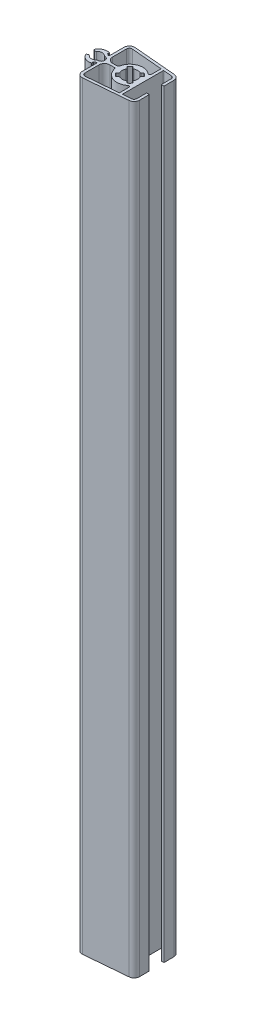
from build123d import *

# Parameters (mm, degrees)
BOSS_EXTRUDE1_DEPTH = 425


with BuildPart() as part:
    # Sketch1 → Boss-Extrude1 (new body)
    with BuildSketch(Plane(origin=(0, 0, 0), x_dir=(1, 0, 0), z_dir=(0, 1, 0))):
        with BuildLine():
            Line((0, 3.65), (0, 11.726074497))
            ThreePointArc((0, 11.726074497), (0.973229377, 13.937906507), (3.261467228, 14.714658591))
            Line((3.261467228, 14.714658591), (27.261467228, 12.614930666))
            ThreePointArc((27.261467228, 12.614930666), (29.21183201, 11.653117195), (30, 9.626346572))
            Line((30, 9.626346572), (30, 4.25))
            ThreePointArc((30, 4.25), (29.956066017, 4.143933983), (29.85, 4.1))
            Line((29.85, 4.1), (28.65, 4.1))
            ThreePointArc((28.65, 4.1), (28.543933983, 4.143933983), (28.5, 4.25))
            Line((28.5, 4.25), (28.5, 9.626346572))
            ThreePointArc((28.5, 9.626346572), (28.105916005, 10.639731884), (27.130733614, 11.120638619))
            Line((27.130733614, 11.120638619), (22.463073361, 11.529005977))
            ThreePointArc((22.463073361, 11.529005977), (22.348661469, 11.490168372), (22.3, 11.379576772))
            Line((22.3, 11.379576772), (22.3, -11.379576772))
            ThreePointArc((22.3, -11.379576772), (22.348661469, -11.490168372), (22.463073361, -11.529005977))
            Line((22.463073361, -11.529005977), (27.130733614, -11.120638619))
            ThreePointArc((27.130733614, -11.120638619), (28.105916005, -10.639731884), (28.5, -9.626346572))
            Line((28.5, -9.626346572), (28.5, -4.25))
            ThreePointArc((28.5, -4.25), (28.543933983, -4.143933983), (28.65, -4.1))
            Line((28.65, -4.1), (29.85, -4.1))
            ThreePointArc((29.85, -4.1), (29.956066017, -4.143933983), (30, -4.25))
            Line((30, -4.25), (30, -9.626346572))
            ThreePointArc((30, -9.626346572), (29.21183201, -11.653117195), (27.261467228, -12.614930666))
            Line((27.261467228, -12.614930666), (3.261467228, -14.714658591))
            ThreePointArc((3.261467228, -14.714658591), (0.973229377, -13.937906507), (0, -11.726074497))
            Line((0, -11.726074497), (0, -3.65))
            ThreePointArc((0, -3.65), (-0.193830765, -3.336772973), (-0.560635258, -3.370477571))
            Line((-0.560635258, -3.370477571), (-1.241594271, -3.883616994))
            ThreePointArc((-1.241594271, -3.883616994), (-1.321364591, -3.936115739), (-1.407159256, -3.978052566))
            ThreePointArc((-1.407159256, -3.978052566), (-1.474647279, -4.03329008), (-1.5, -4.116735006))
            Line((-1.5, -4.116735006), (-1.5, -4.895206856))
            ThreePointArc((-1.5, -4.895206856), (-1.531192993, -4.986775929), (-1.611798603, -5.040260823))
            ThreePointArc((-1.611798603, -5.040260823), (-4.945770747, -4.732123456), (-7.298777867, -2.350175433))
            ThreePointArc((-7.298777867, -2.350175433), (-7.305313905, -2.242111424), (-7.237408738, -2.157793941))
            Line((-7.237408738, -2.157793941), (-6.681980515, -1.837117307))
            ThreePointArc((-6.681980515, -1.837117307), (-6.186662348, -1.74635024), (-5.745584412, -1.989309088))
            ThreePointArc((-5.745584412, -1.989309088), (-3.556386599, -2.999470045), (-1.330769231, -2.072302553))
            ThreePointArc((-1.330769231, -2.072302553), (-1.240582163, -2.011981832), (-1.133333333, -1.995550606))
            ThreePointArc((-1.133333333, -1.995550606), (1, 0), (-1.133333333, 1.995550606))
            ThreePointArc((-1.133333333, 1.995550606), (-1.240582163, 2.011981832), (-1.330769231, 2.072302553))
            ThreePointArc((-1.330769231, 2.072302553), (-3.556386599, 2.999470045), (-5.745584412, 1.989309088))
            ThreePointArc((-5.745584412, 1.989309088), (-6.186662348, 1.74635024), (-6.681980515, 1.837117307))
            Line((-6.681980515, 1.837117307), (-7.237408738, 2.157793941))
            ThreePointArc((-7.237408738, 2.157793941), (-7.305313905, 2.242111424), (-7.298777867, 2.350175433))
            ThreePointArc((-7.298777867, 2.350175433), (-4.945770747, 4.732123456), (-1.611798603, 5.040260823))
            ThreePointArc((-1.611798603, 5.040260823), (-1.531192993, 4.986775929), (-1.5, 4.895206856))
            Line((-1.5, 4.895206856), (-1.5, 4.116735006))
            ThreePointArc((-1.5, 4.116735006), (-1.474647279, 4.03329008), (-1.407159256, 3.978052566))
            ThreePointArc((-1.407159256, 3.978052566), (-1.321364591, 3.936115739), (-1.241594271, 3.883616994))
            Line((-1.241594271, 3.883616994), (-0.560635258, 3.370477571))
            ThreePointArc((-0.560635258, 3.370477571), (-0.193830765, 3.336772973), (0, 3.65))
        make_face()
        with BuildLine():
            Line((1.5, 3.75), (1.5, 11.726074497))
            ThreePointArc((1.5, 11.726074497), (1.986614689, 12.831990502), (3.130733614, 13.220366544))
            Line((3.130733614, 13.220366544), (20.663073361, 11.686485571))
            ThreePointArc((20.663073361, 11.686485571), (20.760591601, 11.638394897), (20.8, 11.537056366))
            Line((20.8, 11.537056366), (20.8, 6.268971207))
            ThreePointArc((20.8, 6.268971207), (20.373749385, 5.592446015), (19.579503106, 5.684905567))
            ThreePointArc((19.579503106, 5.684905567), (12.478865683, 6.850830735), (7.827850799, 1.360248447))
            ThreePointArc((7.827850799, 1.360248447), (7.569361706, 0.92236964), (7.090986155, 0.75))
            Line((7.090986155, 0.75), (4.5, 0.75))
            ThreePointArc((4.5, 0.75), (2.378679656, 1.628679656), (1.5, 3.75))
        make_face(mode=Mode.SUBTRACT)
        with BuildLine():
            Line((3.130733614, -13.220366544), (20.663073361, -11.686485571))
            ThreePointArc((20.663073361, -11.686485571), (20.760591601, -11.638394897), (20.8, -11.537056366))
            Line((20.8, -11.537056366), (20.8, -6.268971207))
            ThreePointArc((20.8, -6.268971207), (20.373749385, -5.592446015), (19.579503106, -5.684905567))
            ThreePointArc((19.579503106, -5.684905567), (12.478865683, -6.850830735), (7.827850799, -1.360248447))
            ThreePointArc((7.827850799, -1.360248447), (7.569361706, -0.92236964), (7.090986155, -0.75))
            Line((7.090986155, -0.75), (4.5, -0.75))
            ThreePointArc((4.5, -0.75), (2.378679656, -1.628679656), (1.5, -3.75))
            Line((1.5, -3.75), (1.5, -11.726074497))
            ThreePointArc((1.5, -11.726074497), (1.986614689, -12.831990502), (3.130733614, -13.220366544))
        make_face(mode=Mode.SUBTRACT)
        with BuildLine():
            Line((11.95237619, 4.744680085), (12.554594319, 4.142461956))
            ThreePointArc((12.554594319, 4.142461956), (12.93723035, 3.937478186), (13.369341573, 3.978813026))
            ThreePointArc((13.369341573, 3.978813026), (15, 4.3), (16.630658427, 3.978813026))
            ThreePointArc((16.630658427, 3.978813026), (17.06276965, 3.937478186), (17.445405681, 4.142461956))
            Line((17.445405681, 4.142461956), (18.04762381, 4.744680085))
            ThreePointArc((18.04762381, 4.744680085), (18.171115834, 4.802453455), (18.302939637, 4.767660826))
            ThreePointArc((18.302939637, 4.767660826), (19.101219331, 4.101219331), (19.767660826, 3.302939637))
            ThreePointArc((19.767660826, 3.302939637), (19.802453455, 3.171115834), (19.744680085, 3.04762381))
            Line((19.744680085, 3.04762381), (19.142461956, 2.445405681))
            ThreePointArc((19.142461956, 2.445405681), (18.937478186, 2.06276965), (18.978813026, 1.630658427))
            ThreePointArc((18.978813026, 1.630658427), (19.3, 0), (18.978813026, -1.630658427))
            ThreePointArc((18.978813026, -1.630658427), (18.937478186, -2.06276965), (19.142461956, -2.445405681))
            Line((19.142461956, -2.445405681), (19.744680085, -3.04762381))
            ThreePointArc((19.744680085, -3.04762381), (19.802453455, -3.171115834), (19.767660826, -3.302939637))
            ThreePointArc((19.767660826, -3.302939637), (19.101219331, -4.101219331), (18.302939637, -4.767660826))
            ThreePointArc((18.302939637, -4.767660826), (18.171115834, -4.802453455), (18.04762381, -4.744680085))
            Line((18.04762381, -4.744680085), (17.445405681, -4.142461956))
            ThreePointArc((17.445405681, -4.142461956), (17.06276965, -3.937478186), (16.630658427, -3.978813026))
            ThreePointArc((16.630658427, -3.978813026), (15, -4.3), (13.369341573, -3.978813026))
            ThreePointArc((13.369341573, -3.978813026), (12.93723035, -3.937478186), (12.554594319, -4.142461956))
            Line((12.554594319, -4.142461956), (11.95237619, -4.744680085))
            ThreePointArc((11.95237619, -4.744680085), (11.828884166, -4.802453455), (11.697060363, -4.767660826))
            ThreePointArc((11.697060363, -4.767660826), (10.898780669, -4.101219331), (10.232339174, -3.302939637))
            ThreePointArc((10.232339174, -3.302939637), (10.197546545, -3.171115834), (10.255319915, -3.04762381))
            Line((10.255319915, -3.04762381), (10.857538044, -2.445405681))
            ThreePointArc((10.857538044, -2.445405681), (11.062521814, -2.06276965), (11.021186974, -1.630658427))
            ThreePointArc((11.021186974, -1.630658427), (10.7, 0), (11.021186974, 1.630658427))
            ThreePointArc((11.021186974, 1.630658427), (11.062521814, 2.06276965), (10.857538044, 2.445405681))
            Line((10.857538044, 2.445405681), (10.255319915, 3.04762381))
            ThreePointArc((10.255319915, 3.04762381), (10.197546545, 3.171115834), (10.232339174, 3.302939637))
            ThreePointArc((10.232339174, 3.302939637), (10.898780669, 4.101219331), (11.697060363, 4.767660826))
            ThreePointArc((11.697060363, 4.767660826), (11.828884166, 4.802453455), (11.95237619, 4.744680085))
        make_face(mode=Mode.SUBTRACT)
    extrude(amount=BOSS_EXTRUDE1_DEPTH)


solid = part.part
